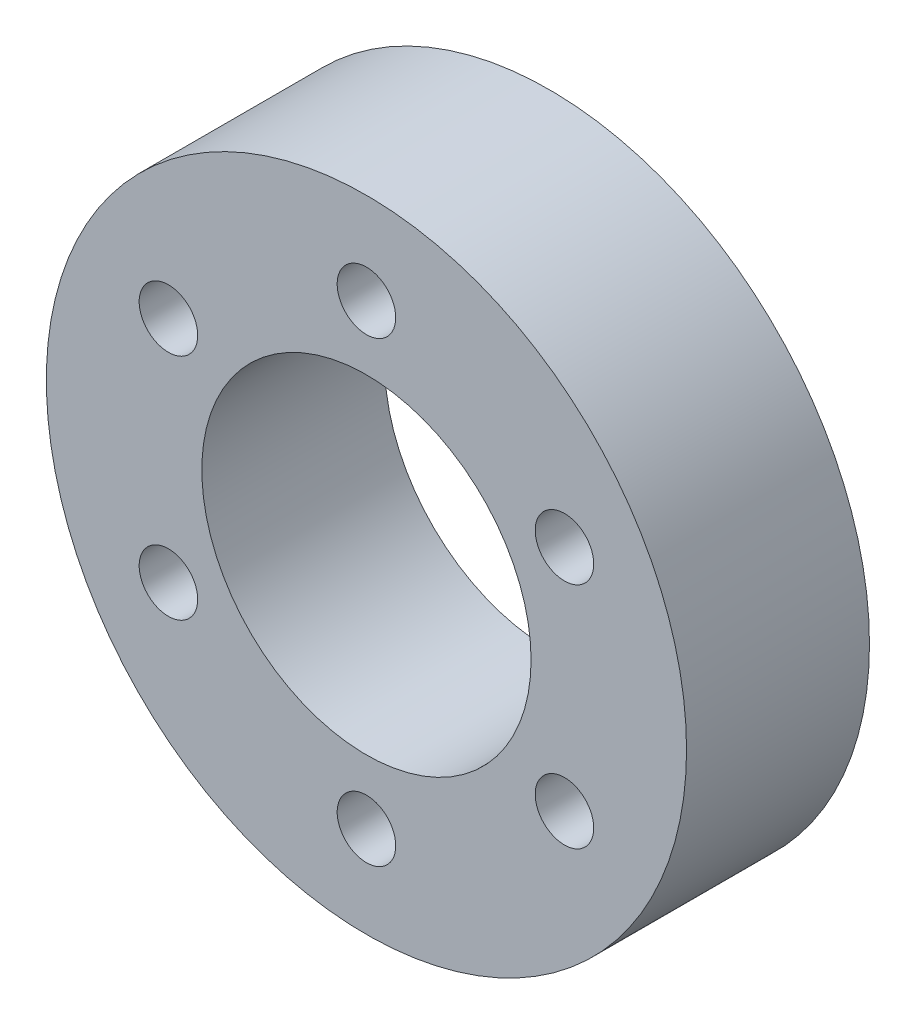
from build123d import *

# Parameters (mm, degrees)
SKETCH1_R           = 17.5
SKETCH1_R_2         = 1.6
SKETCH1_R_3         = 9
BOSS_EXTRUDE1_DEPTH = 10


with BuildPart() as part:
    # Sketch1 → Boss-Extrude1 (new body)
    with BuildSketch(Plane.XY):
        Circle(SKETCH1_R)
        with Locations((0, 12.5)):
            Circle(SKETCH1_R_2, mode=Mode.SUBTRACT)
        with Locations((10.825317547, 6.25)):
            Circle(SKETCH1_R_2, mode=Mode.SUBTRACT)
        with Locations((10.825317547, -6.25)):
            Circle(SKETCH1_R_2, mode=Mode.SUBTRACT)
        with Locations((0, -12.5)):
            Circle(SKETCH1_R_2, mode=Mode.SUBTRACT)
        with Locations((-10.825317547, -6.25)):
            Circle(SKETCH1_R_2, mode=Mode.SUBTRACT)
        with Locations((-10.825317547, 6.25)):
            Circle(SKETCH1_R_2, mode=Mode.SUBTRACT)
        Circle(SKETCH1_R_3, mode=Mode.SUBTRACT)
    extrude(amount=BOSS_EXTRUDE1_DEPTH)


solid = part.part
